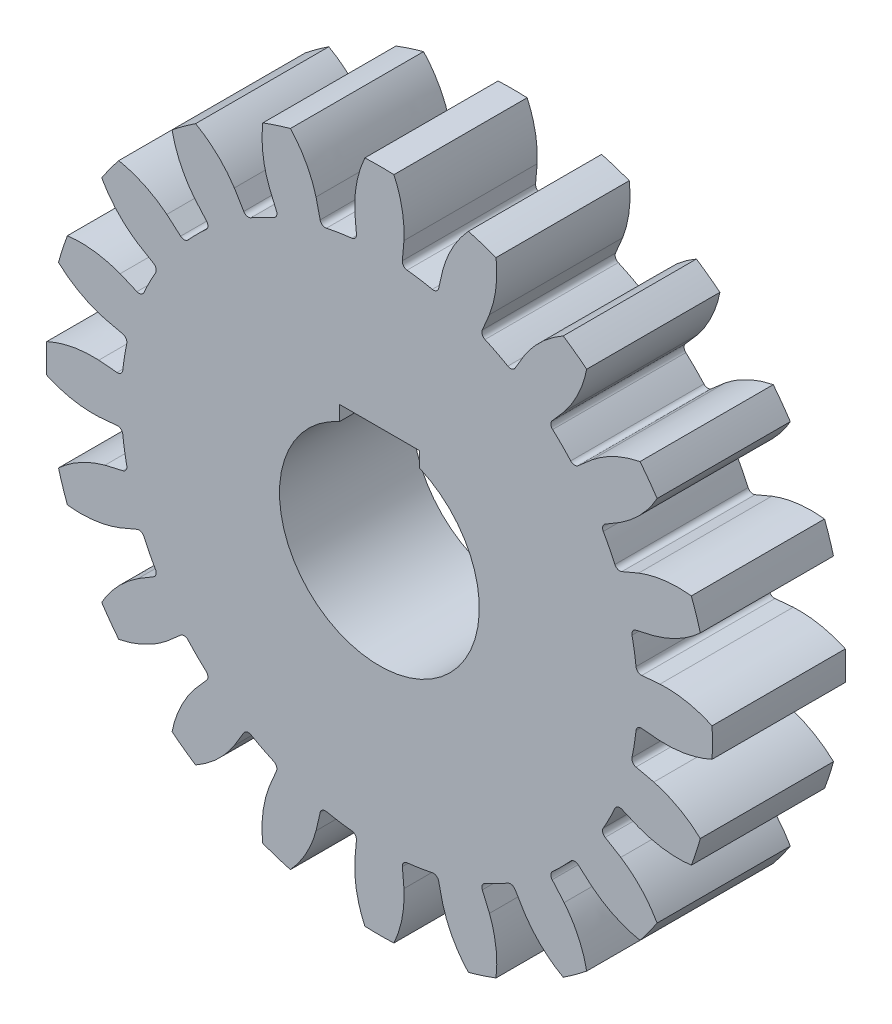
from build123d import *

# Parameters (mm, degrees)
BOSS_EXTRUDE1_DEPTH      = 20
FILLET1_R                = 0.8
CIRPATTERN4_COUNT        = 20
FILLET1_OF_CIRPATTERN4_R = 0.8
CUT_EXTRUDE1_DEPTH       = 74.484692447


with BuildPart() as part:
    # Sketch1 → Boss-Extrude1 (new body)
    with BuildSketch(Plane.XY):
        with BuildLine():
            Line((42.124092809, 3.685380582), (38.602544551, 3.377285031))
            ThreePointArc((38.602544551, 3.377285031), (38.418488378, 5.057889949), (38.161300429, 6.728866885))
            Line((38.161300429, 6.728866885), (0, 0))
            Line((0, 0), (38.161300429, -6.728866885))
            ThreePointArc((38.161300429, -6.728866885), (38.418488378, -5.057889949), (38.602544551, -3.377285031))
            Line((38.602544551, -3.377285031), (42.124092809, -3.685380582))
            add(Edge.make_bspline(
                [(49.952411079, -2.180969368), (46.22913209, -3.884327549), (42.124092809, -3.685380582)],
                knots=[0, 0, 0, 1, 1, 1], degree=2))
            ThreePointArc((49.952411079, -2.180969368), (50, 0), (49.952411079, 2.180969368))
            add(Edge.make_bspline(
                [(49.952411079, 2.180969368), (46.22913209, 3.884327549), (42.124092809, 3.685380582)],
                knots=[0, 0, 0, 1, 1, 1], degree=2))
        make_face()
    boss_extrude1 = extrude(amount=BOSS_EXTRUDE1_DEPTH)

    # Fillet1
    fillet1_edges = [part.edges().sort_by_distance(p)[0] for p in [
        (38.602544551, 3.377285031, 10),
        (38.602544551, -3.377285031, 10),
    ]]
    fillet(fillet1_edges, radius=FILLET1_R)

    # CirPattern4: Boss-Extrude1 ×20 about axis
    cirpattern4_axis = Axis((0, 0, 20), (0, 0, -1))
    for i in range(1, CIRPATTERN4_COUNT):
        add(boss_extrude1.rotate(cirpattern4_axis, i * 360 / CIRPATTERN4_COUNT))

    # Fillet1 of CirPattern4
    fillet1_of_cirpattern4_edges = [part.edges().sort_by_distance(p)[0] for p in [
        (37.75684001, -8.716853356, 10),
        (35.669563071, -15.140831229, 10),
        (33.215232902, -19.957725403, 10),
        (29.244996234, -25.422287373, 10),
        (25.422287373, -29.244996234, 10),
        (19.957725403, -33.215232902, 10),
        (15.140831229, -35.669563071, 10),
        (8.716853356, -37.75684001, 10),
        (3.377285031, -38.602544551, 10),
        (-3.377285031, -38.602544551, 10),
        (-8.716853356, -37.75684001, 10),
        (-15.140831229, -35.669563071, 10),
        (-19.957725403, -33.215232902, 10),
        (-25.422287373, -29.244996234, 10),
        (-29.244996234, -25.422287373, 10),
        (-33.215232902, -19.957725403, 10),
        (-35.669563071, -15.140831229, 10),
        (-37.75684001, -8.716853356, 10),
        (-38.602544551, -3.377285031, 10),
        (-38.602544551, 3.377285031, 10),
        (-37.75684001, 8.716853356, 10),
        (-35.669563071, 15.140831229, 10),
        (-33.215232902, 19.957725403, 10),
        (-29.244996234, 25.422287373, 10),
        (-25.422287373, 29.244996234, 10),
        (-19.957725403, 33.215232902, 10),
        (-15.140831229, 35.669563071, 10),
        (-8.716853356, 37.75684001, 10),
        (-3.377285031, 38.602544551, 10),
        (3.377285031, 38.602544551, 10),
        (8.716853356, 37.75684001, 10),
        (15.140831229, 35.669563071, 10),
        (19.957725403, 33.215232902, 10),
        (25.422287373, 29.244996234, 10),
        (29.244996234, 25.422287373, 10),
        (33.215232902, 19.957725403, 10),
        (35.669563071, 15.140831229, 10),
        (37.75684001, 8.716853356, 10),
    ]]
    fillet(fillet1_of_cirpattern4_edges, radius=FILLET1_OF_CIRPATTERN4_R)

    # Sketch2 → Cut-Extrude1 (cut, through all)
    with BuildSketch(Plane.XY.offset(20)):
        with BuildLine():
            Line((6, 13.747727085), (6, 15.997727085))
            Line((6, 15.997727085), (-6, 15.997727085))
            Line((-6, 15.997727085), (-6, 13.747727085))
            ThreePointArc((-6, 13.747727085), (0, -15), (6, 13.747727085))
        make_face()
    extrude(amount=-CUT_EXTRUDE1_DEPTH, mode=Mode.SUBTRACT)


solid = part.part
